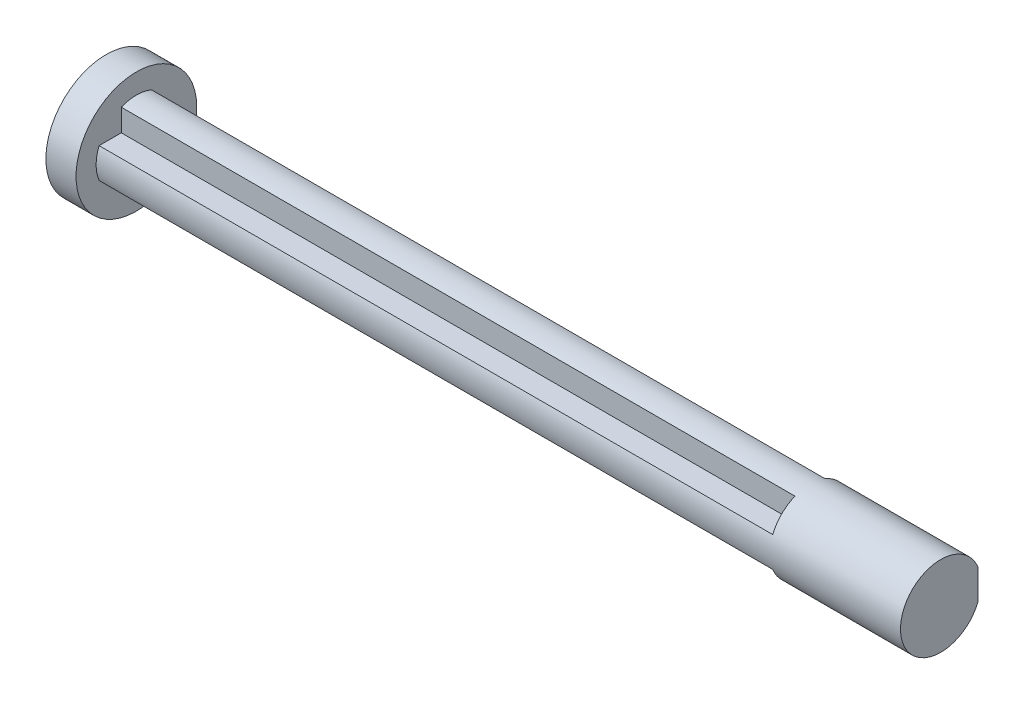
from build123d import *

# Parameters (mm, degrees)
BOSS_EXTRUDE2_DEPTH = 67
SKETCH2_4_R         = 6
BOSS_EXTRUDE3_DEPTH = 3
SKETCH4_R           = 4
BOSS_EXTRUDE5_DEPTH = 2
BOSS_EXTRUDE6_DEPTH = 11
SKETCH8_R           = 1.5
CUT_EXTRUDE1_DEPTH  = 4
BOSS_EXTRUDE7_DEPTH = 11


with BuildPart() as part:
    # Sketch2 → Boss-Extrude2 (new body)
    with BuildSketch(Plane(origin=(0, 0, 0), x_dir=(0, 0, -1), z_dir=(1, 0, 0))):
        with BuildLine():
            ThreePointArc((0, 4), (-0.76406905, 3.92634671), (-1.5, 3.708099244))
            Line((-1.5, 3.708099244), (-1.5, 1.5))
            Line((-1.5, 1.5), (-3.708099244, 1.5))
            ThreePointArc((-3.708099244, 1.5), (-4, 0), (-3.708099244, -1.5))
            Line((-3.708099244, -1.5), (-1.5, -1.5))
            Line((-1.5, -1.5), (-1.5, -3.708099244))
            ThreePointArc((-1.5, -3.708099244), (0, -4), (1.5, -3.708099244))
            Line((1.5, -3.708099244), (1.5, -1.5))
            Line((1.5, -1.5), (3.708099244, -1.5))
            ThreePointArc((3.708099244, -1.5), (4, 0), (3.708099244, 1.5))
            Line((3.708099244, 1.5), (1.5, 1.5))
            Line((1.5, 1.5), (1.5, 3.708099244))
            ThreePointArc((1.5, 3.708099244), (0.76406905, 3.92634671), (0, 4))
        make_face()
    extrude(amount=BOSS_EXTRUDE2_DEPTH)

    # Sketch2<4> → Boss-Extrude3 (add)
    with BuildSketch(Plane(origin=(0, 0, 0), x_dir=(0, 0, -1), z_dir=(1, 0, 0))):
        Circle(SKETCH2_4_R)
    extrude(amount=-BOSS_EXTRUDE3_DEPTH)

    # Sketch4 → Boss-Extrude5 (add)
    with BuildSketch(Plane(origin=(67, 0, 0), x_dir=(0, 0, -1), z_dir=(1, 0, 0))):
        Circle(SKETCH4_R)
    extrude(amount=BOSS_EXTRUDE5_DEPTH)

    # Sketch7 → Boss-Extrude6 (add)
    with BuildSketch(Plane(origin=(69, 0, 0), x_dir=(0, 0, -1), z_dir=(1, 0, 0))):
        with BuildLine():
            Line((-3.708099244, 1.5), (-3.708099244, -1.5))
            ThreePointArc((-3.708099244, -1.5), (0, -4), (3.708099244, -1.5))
            Line((3.708099244, -1.5), (3.708099244, 1.5))
            ThreePointArc((3.708099244, 1.5), (0, 4), (-3.708099244, 1.5))
        make_face()
    extrude(amount=BOSS_EXTRUDE6_DEPTH)

    # Sketch8 → Cut-Extrude1 (cut)
    with BuildSketch(Plane(origin=(0, 0, -3.708099244), x_dir=(-1, 0, 0), z_dir=(0, 0, -1))):
        with Locations((-75, 0)):
            Circle(SKETCH8_R)
    extrude(amount=-CUT_EXTRUDE1_DEPTH, mode=Mode.SUBTRACT)

    # Sketch7<2> → Boss-Extrude7 (add)
    with BuildSketch(Plane(origin=(69, 0, 0), x_dir=(0, 0, -1), z_dir=(1, 0, 0))):
        with BuildLine():
            Line((-3.708099244, -1.5), (-3.708099244, 1.5))
            ThreePointArc((-3.708099244, 1.5), (-4, 0), (-3.708099244, -1.5))
        make_face()
    extrude(amount=BOSS_EXTRUDE7_DEPTH)


solid = part.part
